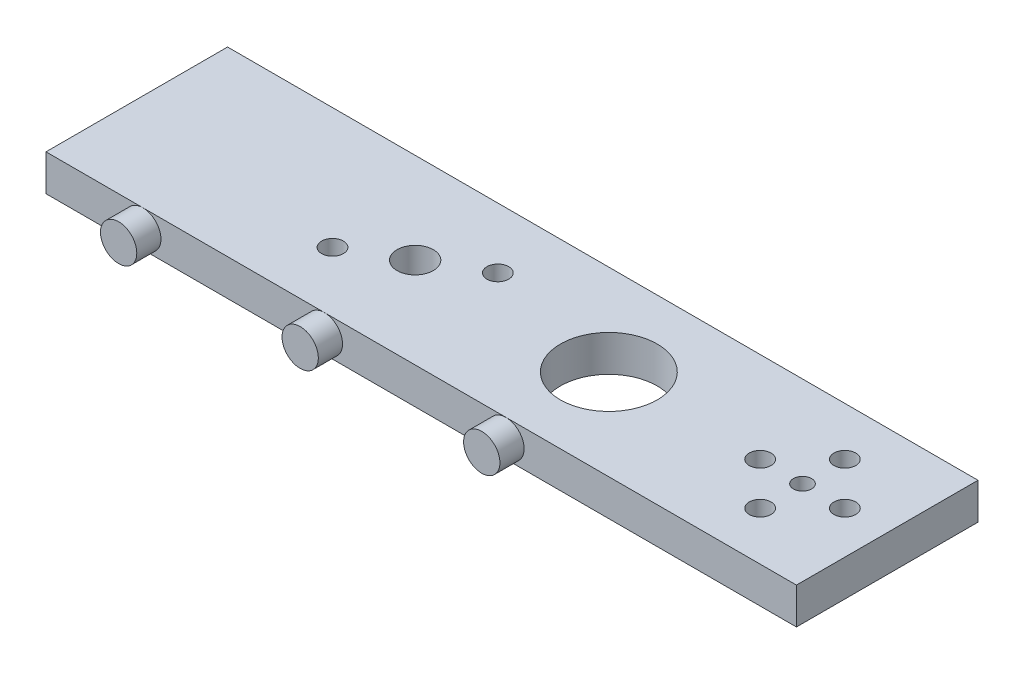
from build123d import *

# Parameters (mm, degrees)
SKETCH_1_W      = 62
SKETCH_1_H      = 15
SKETCH_1_R      = 1.5
SKETCH_1_R_2    = 0.9
SKETCH_1_R_3    = 4
SKETCH_1_R_4    = 0.75
EXTRUDE_1_DEPTH = 3
SKETCH_2_R      = 1.5
EXTRUDE_2_DEPTH = 2


with BuildPart() as part:
    # 草图1 → 凸台-拉伸1 (new body)
    with BuildSketch(Plane(origin=(0, 0, 0), x_dir=(1, 0, 0), z_dir=(0, 1, 0))):
        Rectangle(SKETCH_1_W, SKETCH_1_H)
        with Locations(Location((-8, 0, 0), (0, 0, 270))):
            Circle(SKETCH_1_R, mode=Mode.SUBTRACT)
        with Locations(Location((-3.669872981, 2.5, 0), (0, 0, 270))):
            Circle(SKETCH_1_R_2, mode=Mode.SUBTRACT)
        with Locations(Location((-12.330127019, -2.5, 0), (0, 0, 270))):
            Circle(SKETCH_1_R_2, mode=Mode.SUBTRACT)
        with Locations(Location((8, 0, 0), (0, 0, 270))):
            Circle(SKETCH_1_R_3, mode=Mode.SUBTRACT)
        with Locations(Location((24, 0, 0), (0, 0, 270))):
            Circle(SKETCH_1_R_4, mode=Mode.SUBTRACT)
        with Locations(Location((27.5, 0, 0), (0, 0, 270))):
            Circle(SKETCH_1_R_2, mode=Mode.SUBTRACT)
        with Locations(Location((24, -3.5, 0), (0, 0, 270))):
            Circle(SKETCH_1_R_2, mode=Mode.SUBTRACT)
        with Locations(Location((20.5, 0, 0), (0, 0, 270))):
            Circle(SKETCH_1_R_2, mode=Mode.SUBTRACT)
        with Locations(Location((24, 3.5, 0), (0, 0, 270))):
            Circle(SKETCH_1_R_2, mode=Mode.SUBTRACT)
    extrude(amount=EXTRUDE_1_DEPTH)

    # 草图2 → 凸台-拉伸2 (add)
    with BuildSketch(Plane.XY.offset(7.5)):
        with Locations(Location((-23, 1.5, 0), (0, 0, 270))):
            Circle(SKETCH_2_R)
        with Locations(Location((-8, 1.5, 0), (0, 0, 270))):
            Circle(SKETCH_2_R)
        with Locations(Location((7, 1.5, 0), (0, 0, 270))):
            Circle(SKETCH_2_R)
    extrude(amount=EXTRUDE_2_DEPTH)


solid = part.part
